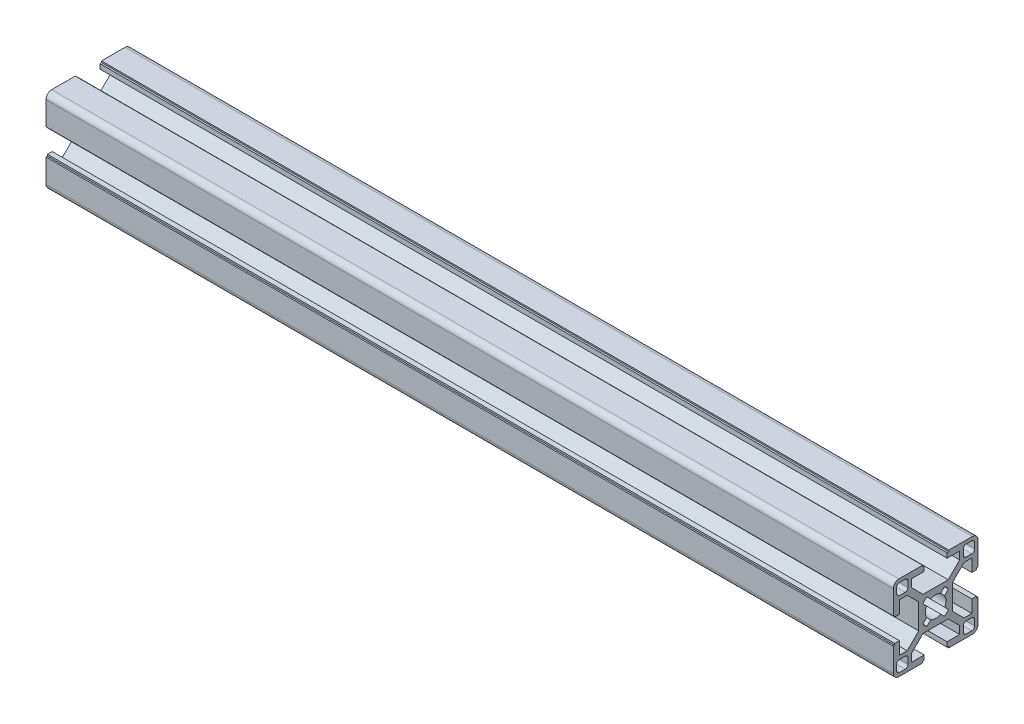
from build123d import *

# Parameters (mm, degrees)
AUFSATZ_LINEAR_AUSTRAGEN1_DEPTH = 400
SCALE1_SCALE_X                  = 1
SCALE1_SCALE_Y                  = 1.333333333
SCALE1_SCALE_Z                  = 1.333333333


with BuildPart() as part:
    # Skizze1 → Aufsatz-Linear austragen1 (new body)
    with BuildSketch(Plane(origin=(0, 0, 0), x_dir=(0, 0, -1), z_dir=(1, 0, 0))):
        with BuildLine():
            Line((10.055634919, 8.5), (12.8, 8.5))
            Line((12.8, 8.5), (12.8, 4.05))
            Line((12.8, 4.05), (14.5, 4.05))
            Line((14.5, 4.05), (14.5, 4.651637069))
            Line((14.5, 4.651637069), (15, 4.651637069))
            Line((15, 4.651637069), (15, 13))
            ThreePointArc((15, 13), (14.414213562, 14.414213562), (13, 15))
            Line((13, 15), (4.651637069, 15))
            Line((4.651637069, 15), (4.651637069, 14.5))
            Line((4.651637069, 14.5), (4.05, 14.5))
            Line((4.05, 14.5), (4.05, 12.8))
            Line((4.05, 12.8), (8.5, 12.8))
            Line((8.5, 12.8), (8.5, 10.055634919))
            Line((8.5, 10.055634919), (4.444365081, 6))
            Line((4.444365081, 6), (-4.444365081, 6))
            Line((-4.444365081, 6), (-8.5, 10.055634919))
            Line((-8.5, 10.055634919), (-8.5, 12.8))
            Line((-8.5, 12.8), (-4.05, 12.8))
            Line((-4.05, 12.8), (-4.05, 14.5))
            Line((-4.05, 14.5), (-4.651637069, 14.5))
            Line((-4.651637069, 14.5), (-4.651637069, 15))
            Line((-4.651637069, 15), (-13, 15))
            ThreePointArc((-13, 15), (-14.414213562, 14.414213562), (-15, 13))
            Line((-15, 13), (-15, 4.651637069))
            Line((-15, 4.651637069), (-14.5, 4.651637069))
            Line((-14.5, 4.651637069), (-14.5, 4.05))
            Line((-14.5, 4.05), (-12.8, 4.05))
            Line((-12.8, 4.05), (-12.8, 8.5))
            Line((-12.8, 8.5), (-10.055634919, 8.5))
            Line((-10.055634919, 8.5), (-6, 4.444365081))
            Line((-6, 4.444365081), (-6, -4.444365081))
            Line((-6, -4.444365081), (-10.055634919, -8.5))
            Line((-10.055634919, -8.5), (-12.8, -8.5))
            Line((-12.8, -8.5), (-12.8, -4.05))
            Line((-12.8, -4.05), (-14.5, -4.05))
            Line((-14.5, -4.05), (-14.5, -4.651637069))
            Line((-14.5, -4.651637069), (-15, -4.651637069))
            Line((-15, -4.651637069), (-15, -13))
            ThreePointArc((-15, -13), (-14.414213562, -14.414213562), (-13, -15))
            Line((-13, -15), (-4.651637069, -15))
            Line((-4.651637069, -15), (-4.651637069, -14.5))
            Line((-4.651637069, -14.5), (-4.05, -14.5))
            Line((-4.05, -14.5), (-4.05, -12.8))
            Line((-4.05, -12.8), (-8.5, -12.8))
            Line((-8.5, -12.8), (-8.5, -10.055634919))
            Line((-8.5, -10.055634919), (-4.444365081, -6))
            Line((-4.444365081, -6), (4.444365081, -6))
            Line((4.444365081, -6), (8.5, -10.055634919))
            Line((8.5, -10.055634919), (8.5, -12.8))
            Line((8.5, -12.8), (4.05, -12.8))
            Line((4.05, -12.8), (4.05, -14.5))
            Line((4.05, -14.5), (4.651637069, -14.5))
            Line((4.651637069, -14.5), (4.651637069, -15))
            Line((4.651637069, -15), (13, -15))
            ThreePointArc((13, -15), (14.414213562, -14.414213562), (15, -13))
            Line((15, -13), (15, -4.651637069))
            Line((15, -4.651637069), (14.5, -4.651637069))
            Line((14.5, -4.651637069), (14.5, -4.05))
            Line((14.5, -4.05), (12.8, -4.05))
            Line((12.8, -4.05), (12.8, -8.5))
            Line((12.8, -8.5), (10.055634919, -8.5))
            Line((10.055634919, -8.5), (6, -4.444365081))
            Line((6, -4.444365081), (6, 4.444365081))
            Line((6, 4.444365081), (10.055634919, 8.5))
        make_face()
        with BuildLine():
            ThreePointArc((12.8, 13.8), (13.507106781, 13.507106781), (13.8, 12.8))
            Line((13.8, 12.8), (13.8, 10.8))
            ThreePointArc((13.8, 10.8), (13.507106781, 10.092893219), (12.8, 9.8))
            Line((12.8, 9.8), (10.8, 9.8))
            ThreePointArc((10.8, 9.8), (10.092893219, 10.092893219), (9.8, 10.8))
            Line((9.8, 10.8), (9.8, 12.8))
            ThreePointArc((9.8, 12.8), (10.092893219, 13.507106781), (10.8, 13.8))
            Line((10.8, 13.8), (12.8, 13.8))
        make_face(mode=Mode.SUBTRACT)
        with BuildLine():
            Line((-3.117157854, 4.531371416), (-1.775079755, 3.189293317))
            ThreePointArc((-1.775079755, 3.189293317), (0, 3.65), (1.775079755, 3.189293317))
            Line((1.775079755, 3.189293317), (3.117157854, 4.531371416))
            ThreePointArc((3.117157854, 4.531371416), (3.889087297, 3.889087297), (4.531371416, 3.117157854))
            Line((4.531371416, 3.117157854), (3.189293317, 1.775079755))
            ThreePointArc((3.189293317, 1.775079755), (3.65, 0), (3.189293317, -1.775079755))
            Line((3.189293317, -1.775079755), (4.531371416, -3.117157854))
            ThreePointArc((4.531371416, -3.117157854), (3.889087297, -3.889087297), (3.117157854, -4.531371416))
            Line((3.117157854, -4.531371416), (1.775079755, -3.189293317))
            ThreePointArc((1.775079755, -3.189293317), (0, -3.65), (-1.775079755, -3.189293317))
            Line((-1.775079755, -3.189293317), (-3.117157854, -4.531371416))
            ThreePointArc((-3.117157854, -4.531371416), (-3.889087297, -3.889087297), (-4.531371416, -3.117157854))
            Line((-4.531371416, -3.117157854), (-3.189293317, -1.775079755))
            ThreePointArc((-3.189293317, -1.775079755), (-3.65, 0), (-3.189293317, 1.775079755))
            Line((-3.189293317, 1.775079755), (-4.531371416, 3.117157854))
            ThreePointArc((-4.531371416, 3.117157854), (-3.889087297, 3.889087297), (-3.117157854, 4.531371416))
        make_face(mode=Mode.SUBTRACT)
        with BuildLine():
            ThreePointArc((-13.8, 12.8), (-13.507106781, 13.507106781), (-12.8, 13.8))
            Line((-12.8, 13.8), (-10.8, 13.8))
            ThreePointArc((-10.8, 13.8), (-10.092893219, 13.507106781), (-9.8, 12.8))
            Line((-9.8, 12.8), (-9.8, 10.8))
            ThreePointArc((-9.8, 10.8), (-10.092893219, 10.092893219), (-10.8, 9.8))
            Line((-10.8, 9.8), (-12.8, 9.8))
            ThreePointArc((-12.8, 9.8), (-13.507106781, 10.092893219), (-13.8, 10.8))
            Line((-13.8, 10.8), (-13.8, 12.8))
        make_face(mode=Mode.SUBTRACT)
        with BuildLine():
            ThreePointArc((9.8, -10.8), (10.092893219, -10.092893219), (10.8, -9.8))
            Line((10.8, -9.8), (12.8, -9.8))
            ThreePointArc((12.8, -9.8), (13.507106781, -10.092893219), (13.8, -10.8))
            Line((13.8, -10.8), (13.8, -12.8))
            ThreePointArc((13.8, -12.8), (13.507106781, -13.507106781), (12.8, -13.8))
            Line((12.8, -13.8), (10.8, -13.8))
            ThreePointArc((10.8, -13.8), (10.092893219, -13.507106781), (9.8, -12.8))
            Line((9.8, -12.8), (9.8, -10.8))
        make_face(mode=Mode.SUBTRACT)
        with BuildLine():
            Line((-9.8, -10.8), (-9.8, -12.8))
            ThreePointArc((-9.8, -12.8), (-10.092893219, -13.507106781), (-10.8, -13.8))
            Line((-10.8, -13.8), (-12.8, -13.8))
            ThreePointArc((-12.8, -13.8), (-13.507106781, -13.507106781), (-13.8, -12.8))
            Line((-13.8, -12.8), (-13.8, -10.8))
            ThreePointArc((-13.8, -10.8), (-13.507106781, -10.092893219), (-12.8, -9.8))
            Line((-12.8, -9.8), (-10.8, -9.8))
            ThreePointArc((-10.8, -9.8), (-10.092893219, -10.092893219), (-9.8, -10.8))
        make_face(mode=Mode.SUBTRACT)
    extrude(amount=AUFSATZ_LINEAR_AUSTRAGEN1_DEPTH)


with BuildPart() as part_1:
    # Scale1: scaled about (200, 0, 0)
    add(part.part.scale((SCALE1_SCALE_X, SCALE1_SCALE_Y, SCALE1_SCALE_Z), about=(200, 0, 0)))


solid = part_1.part
